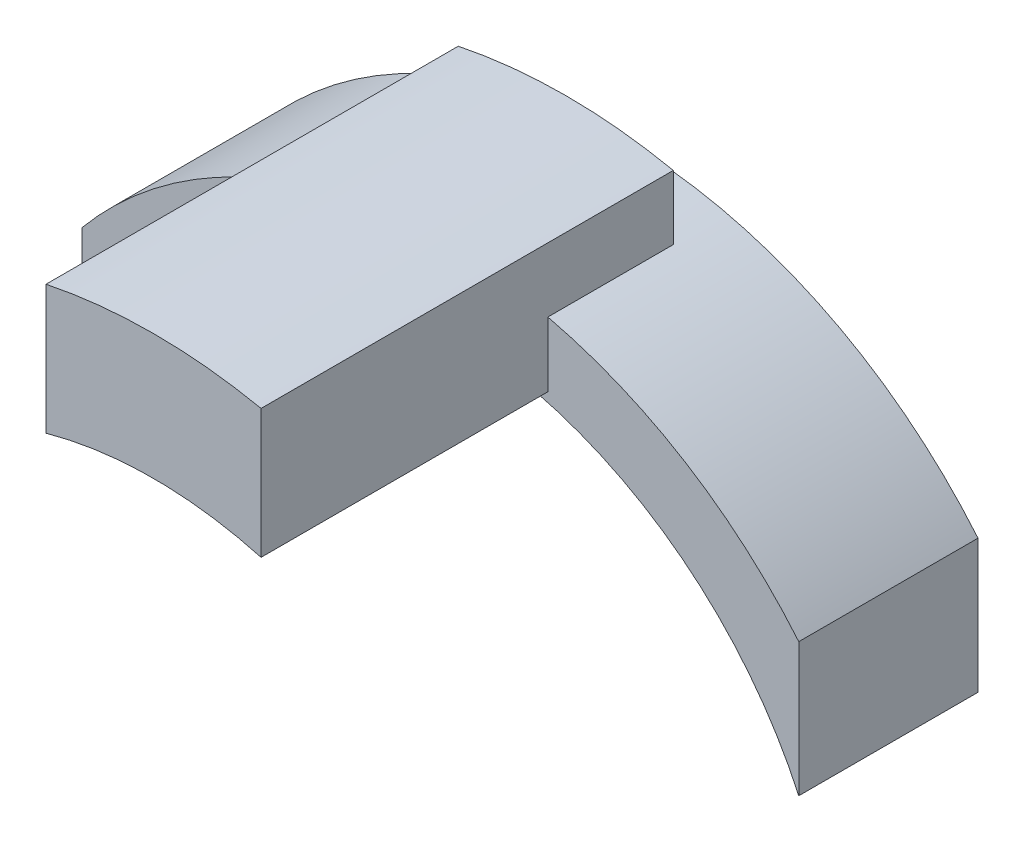
from build123d import *

# Parameters (mm, degrees)
EXTRUDE1_DEPTH      = 5
EXTRUDE2_DEPTH      = 7
EXTRUDE2_DEPTH_BACK = 16


with BuildPart() as part:
    # Sketch1 → Extrude1 (new, symmetric)
    with BuildSketch(Plane.XY):
        with BuildLine():
            Line((-20, 9.16515139), (-20, 16.613247726))
            ThreePointArc((-20, 16.613247726), (0, 26), (20, 16.613247726))
            Line((20, 16.613247726), (20, 9.16515139))
            ThreePointArc((20, 9.16515139), (0, 22), (-20, 9.16515139))
        make_face()
    extrude(amount=EXTRUDE1_DEPTH, both=True)

    # Sketch2 → Extrude2 (add, two sides: drawn at the far end of the back side and taken through both)
    with BuildSketch(Plane(origin=(0, 0, 5), x_dir=(-1, 0, 0), z_dir=(0, 0, -1)).offset(-EXTRUDE2_DEPTH_BACK)):
        with BuildLine():
            Line((6, 21.685248442), (6, 28.883386228))
            ThreePointArc((6, 28.883386228), (0, 29.5), (-6, 28.883386228))
            Line((-6, 28.883386228), (-6, 21.685248442))
            ThreePointArc((-6, 21.685248442), (0, 22.5), (6, 21.685248442))
        make_face()
    extrude(amount=EXTRUDE2_DEPTH + EXTRUDE2_DEPTH_BACK)


solid = part.part
